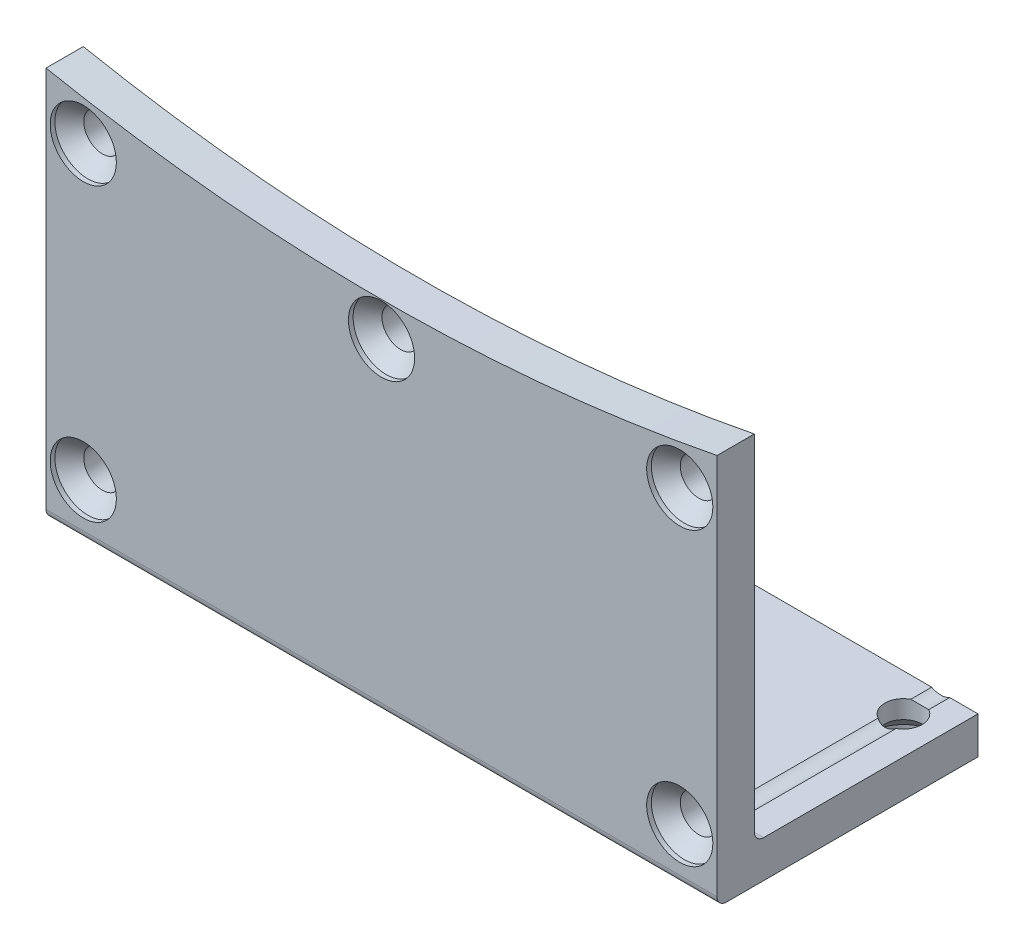
from build123d import *

# Parameters (mm, degrees)
BOSS_EXTRUDE1_DEPTH                          = 4
SKETCH2_W                                    = 72
SKETCH2_H                                    = 4
BOSS_EXTRUDE2_DEPTH                          = 24
CSK_FOR_M4_COUNTERSUNK_FLAT_HEAD_SCR_2_COUNT = 2
CSK_FOR_M4_COUNTERSUNK_FLAT_HEAD_SCR_2_PITCH = 31.257513815
CSK_FOR_M4_COUNTERSUNK_FLAT_HEAD_SCR_3_COUNT = 2
CSK_FOR_M4_COUNTERSUNK_FLAT_HEAD_SCR_3_PITCH = 43.237884498
CSK_FOR_M4_COUNTERSUNK_FLAT_HEAD_SCR_4_COUNT = 2
CSK_FOR_M4_COUNTERSUNK_FLAT_HEAD_SCR_4_PITCH = 71.225221445
CSK_FOR_M4_COUNTERSUNK_FLAT_HEAD_SCR_5_COUNT = 2
CSK_FOR_M4_COUNTERSUNK_FLAT_HEAD_SCR_5_PITCH = 64
CSK_FOR_M4_COUNTERSUNK_FLAT_HEAD_SCR_6_COUNT = 2
CSK_FOR_M4_COUNTERSUNK_FLAT_HEAD_SCR_6_PITCH = 32
CSK_FOR_M4_COUNTERSUNK_FLAT_HEAD_SCR_7_COUNT = 2
CSK_FOR_M4_COUNTERSUNK_FLAT_HEAD_SCR_7_PITCH = 64
FILLET1_R                                    = 1
FILLET2_R                                    = 1


with BuildPart() as part:
    # Sketch1 → Boss-Extrude1 (new body)
    with BuildSketch(Plane.XY):
        with BuildLine():
            Line((36, -225), (36, -182.992486185))
            ThreePointArc((36, -182.992486185), (0, -186.5), (-36, -182.992486185))
            Line((-36, -182.992486185), (-36, -225))
            Line((-36, -225), (36, -225))
        make_face()
    extrude(amount=-BOSS_EXTRUDE1_DEPTH)

    # Sketch2 → Boss-Extrude2 (add)
    with BuildSketch(Plane(origin=(0, 0, -4), x_dir=(-1, 0, 0), z_dir=(0, 0, -1))):
        with Locations((0, -223)):
            Rectangle(SKETCH2_W, SKETCH2_H)
    extrude(amount=BOSS_EXTRUDE2_DEPTH)

    # Sketch7 → CSK for M4 Countersunk Flat Head Screw1 (revolve, cut)
    with BuildSketch(Plane(origin=(-32, -219.25, 0), x_dir=(0, -1, 0), z_dir=(1, 0, 0))):
        Polygon((0, 0), (0, 28), (2, 28), (2, 2.05), (3.55, 0.5), (3.55, 0), align=None)
    csk_for_m4_countersunk_flat_head_screw1 = revolve(axis=Axis((-32, -219.25, 6.35), (0, 0, -1)), mode=Mode.SUBTRACT)

    # CSK for M4 Countersunk Flat Head Scr 2: CSK for M4 Countersunk Flat Head Screw1 ×2
    with Locations(*[(0, i * CSK_FOR_M4_COUNTERSUNK_FLAT_HEAD_SCR_2_PITCH, 0) for i in range(1, CSK_FOR_M4_COUNTERSUNK_FLAT_HEAD_SCR_2_COUNT)]):
        add(csk_for_m4_countersunk_flat_head_screw1, mode=Mode.SUBTRACT)

    # CSK for M4 Countersunk Flat Head Scr 3: CSK for M4 Countersunk Flat Head Screw1 ×2
    with Locations(*[Vector(0.74009171288563, 0.6725059527751515, 0) * (i * CSK_FOR_M4_COUNTERSUNK_FLAT_HEAD_SCR_3_PITCH) for i in range(1, CSK_FOR_M4_COUNTERSUNK_FLAT_HEAD_SCR_3_COUNT)]):
        add(csk_for_m4_countersunk_flat_head_screw1, mode=Mode.SUBTRACT)

    # CSK for M4 Countersunk Flat Head Scr 4: CSK for M4 Countersunk Flat Head Screw1 ×2
    with Locations(*[Vector(0.8985581048590322, 0.4388545683847263, 0) * (i * CSK_FOR_M4_COUNTERSUNK_FLAT_HEAD_SCR_4_PITCH) for i in range(1, CSK_FOR_M4_COUNTERSUNK_FLAT_HEAD_SCR_4_COUNT)]):
        add(csk_for_m4_countersunk_flat_head_screw1, mode=Mode.SUBTRACT)

    # CSK for M4 Countersunk Flat Head Scr 5: CSK for M4 Countersunk Flat Head Screw1 ×2
    with Locations(*[(i * CSK_FOR_M4_COUNTERSUNK_FLAT_HEAD_SCR_5_PITCH, 0, 0) for i in range(1, CSK_FOR_M4_COUNTERSUNK_FLAT_HEAD_SCR_5_COUNT)]):
        add(csk_for_m4_countersunk_flat_head_screw1, mode=Mode.SUBTRACT)

    # Sketch9 → CSK for M4 Countersunk Flat Head Screw2 (revolve, cut)
    with BuildSketch(Plane(origin=(32, -225, -24), x_dir=(0, 0, -1), z_dir=(1, 0, 0))):
        Polygon((0, 0), (0, 42.007513815), (2, 42.007513815), (2, 2.05), (3.55, 0.5), (3.55, 0), align=None)
    csk_for_m4_countersunk_flat_head_screw2 = revolve(axis=Axis((32, -231.35, -24), (0, 1, 0)), mode=Mode.SUBTRACT)

    # CSK for M4 Countersunk Flat Head Scr 6: CSK for M4 Countersunk Flat Head Screw2 ×2
    with Locations(*[(-i * CSK_FOR_M4_COUNTERSUNK_FLAT_HEAD_SCR_6_PITCH, 0, 0) for i in range(1, CSK_FOR_M4_COUNTERSUNK_FLAT_HEAD_SCR_6_COUNT)]):
        add(csk_for_m4_countersunk_flat_head_screw2, mode=Mode.SUBTRACT)

    # CSK for M4 Countersunk Flat Head Scr 7: CSK for M4 Countersunk Flat Head Screw2 ×2
    with Locations(*[(-i * CSK_FOR_M4_COUNTERSUNK_FLAT_HEAD_SCR_7_PITCH, 0, 0) for i in range(1, CSK_FOR_M4_COUNTERSUNK_FLAT_HEAD_SCR_7_COUNT)]):
        add(csk_for_m4_countersunk_flat_head_screw2, mode=Mode.SUBTRACT)

    # Fillet1
    fillet1_edges = [part.edges().sort_by_distance(p)[0] for p in [
        (0, -225, 0),
    ]]
    fillet(fillet1_edges, radius=FILLET1_R)

    # Fillet2
    fillet2_edges = [part.edges().sort_by_distance(p)[0] for p in [
        (-34.484122918, -221, -4),
        (34.484122918, -221, -4),
        (0, -221, -4),
    ]]
    fillet(fillet2_edges, radius=FILLET2_R)


solid = part.part
